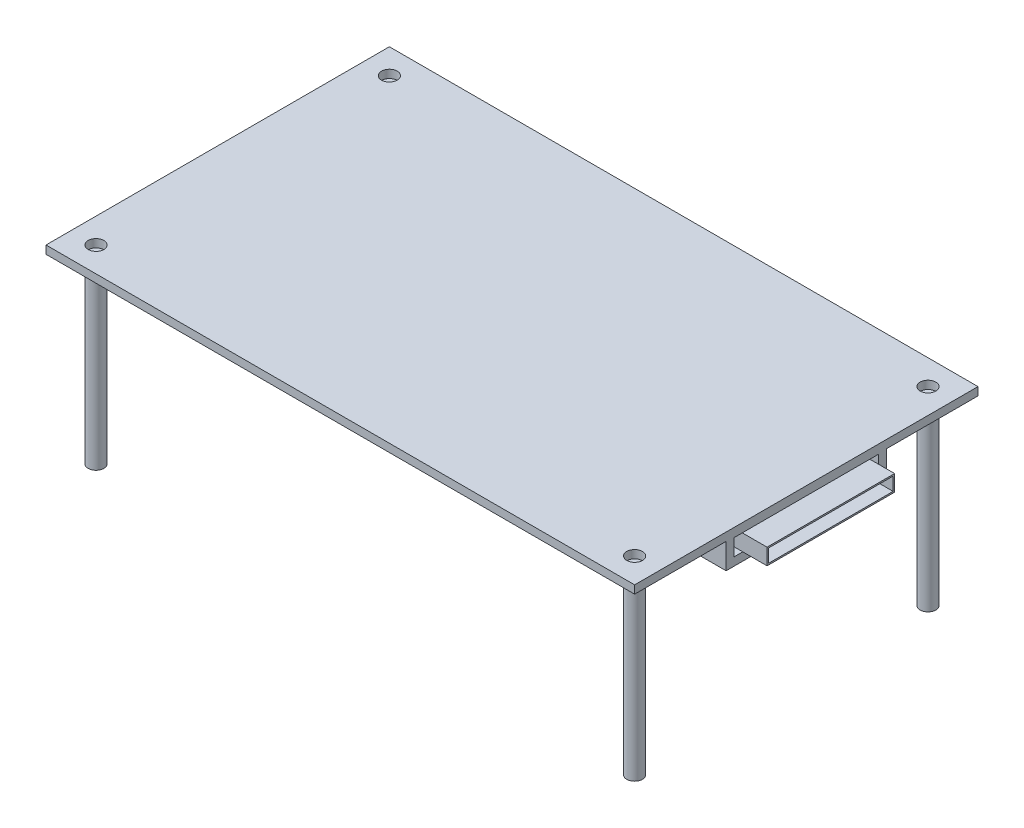
from build123d import *

# Parameters (mm, degrees)
SKETCH1_W                = 29.4
SKETCH1_H                = 3.4
BOSS_EXTRUDE1_DEPTH      = 60
SKETCH2_R                = 1.6
CUT_EXTRUDE2_DEPTH       = 1.65
BOSS_EXTRUDE2_DEPTH      = 5
BOSS_EXTRUDE2_DEPTH_BACK = 5
SKETCH3_W                = 26
SKETCH3_H                = 3.3
SKETCH3_W_2              = 25.4
SKETCH3_H_2              = 2.7
SKETCH4_R                = 1.6
BOSS_EXTRUDE3_DEPTH      = 37
BOSS_EXTRUDE3_2_DEPTH    = 37
BOSS_EXTRUDE3_3_DEPTH    = 37
BOSS_EXTRUDE3_4_DEPTH    = 37


with BuildPart() as part:
    # Sketch1 → Boss-Extrude1 (new, symmetric)
    with BuildSketch(Plane(origin=(0, 0, 0), x_dir=(0, 0, -1), z_dir=(1, 0, 0))):
        Polygon((-35, 1.85), (-16.35, 1.85), (-16.35, -3.35), (16.35, -3.35), (16.35, 1.85), (35, 1.85), (35, 3.5), (-35, 3.5), align=None)
        Rectangle(SKETCH1_W, SKETCH1_H, mode=Mode.SUBTRACT)
    extrude(amount=BOSS_EXTRUDE1_DEPTH, both=True)

    # Sketch2 → Cut-Extrude2 (cut)
    with BuildSketch(Plane(origin=(0, 3.5, 0), x_dir=(1, 0, 0), z_dir=(0, 1, 0))):
        with Locations(Location((-54.9, 29.9, 0), (0, 0, 270))):
            Circle(SKETCH2_R)
        with Locations(Location((-54.9, -29.9, 0), (0, 0, 270))):
            Circle(SKETCH2_R)
        with Locations(Location((54.9, -29.9, 0), (0, 0, 270))):
            Circle(SKETCH2_R)
        with Locations(Location((54.9, 29.9, 0), (0, 0, 270))):
            Circle(SKETCH2_R)
    extrude(amount=-CUT_EXTRUDE2_DEPTH, mode=Mode.SUBTRACT)


with BuildPart() as body_2:
    # Sketch3 → Boss-Extrude2 (new, two sides: drawn at the far end of the back side and taken through both)
    with BuildSketch(Plane(origin=(60, 0, 0), x_dir=(0, 0, -1), z_dir=(1, 0, 0)).offset(-BOSS_EXTRUDE2_DEPTH_BACK)):
        Rectangle(SKETCH3_W, SKETCH3_H)
        Rectangle(SKETCH3_W_2, SKETCH3_H_2, mode=Mode.SUBTRACT)
    extrude(amount=BOSS_EXTRUDE2_DEPTH + BOSS_EXTRUDE2_DEPTH_BACK)


with BuildPart() as body_3:
    # Sketch4 → Boss-Extrude3 (new body)
    with BuildSketch(Plane.XZ.offset(-1.85)):
        with Locations(Location((-54.9, -29.9, 0), (0, 0, 270))):
            Circle(SKETCH4_R)
    extrude(amount=BOSS_EXTRUDE3_DEPTH)


with BuildPart() as body_4:
    # Sketch4 → Boss-Extrude3 2 (new body)
    with BuildSketch(Plane.XZ.offset(-1.85)):
        with Locations(Location((54.9, -29.9, 0), (0, 0, 270))):
            Circle(SKETCH4_R)
    extrude(amount=BOSS_EXTRUDE3_2_DEPTH)


with BuildPart() as body_5:
    # Sketch4 → Boss-Extrude3 3 (new body)
    with BuildSketch(Plane.XZ.offset(-1.85)):
        with Locations(Location((54.9, 29.9, 0), (0, 0, 270))):
            Circle(SKETCH4_R)
    extrude(amount=BOSS_EXTRUDE3_3_DEPTH)


with BuildPart() as body_6:
    # Sketch4 → Boss-Extrude3 4 (new body)
    with BuildSketch(Plane.XZ.offset(-1.85)):
        with Locations(Location((-54.9, 29.9, 0), (0, 0, 270))):
            Circle(SKETCH4_R)
    extrude(amount=BOSS_EXTRUDE3_4_DEPTH)


solid = Compound([part.part, body_2.part, body_3.part, body_4.part, body_5.part, body_6.part])
